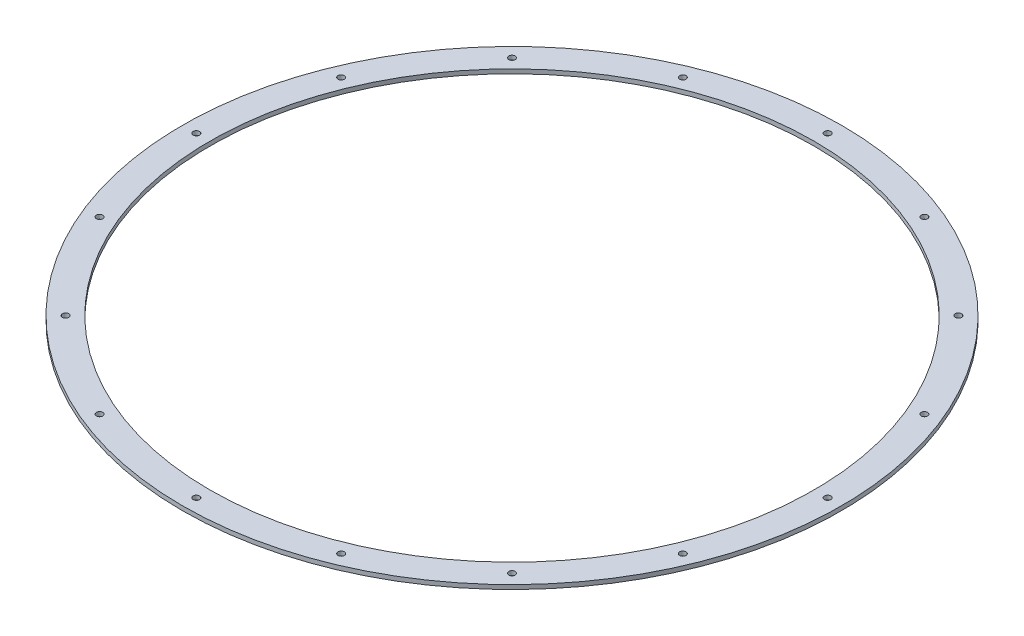
from build123d import *

# Parameters (mm, degrees)
SKETCH2_R           = 462
SKETCH2_R_2         = 423.5
BOSS_EXTRUDE1_DEPTH = 6
SKETCH3_R           = 4.5
CUT_EXTRUDE1_DEPTH  = 46
CIRPATTERN1_COUNT   = 16


with BuildPart() as part:
    # Sketch2 → Boss-Extrude1 (new body)
    with BuildSketch(Plane(origin=(0, 0, 0), x_dir=(1, 0, 0), z_dir=(0, 1, 0))):
        with Locations(Location((0, 0, 0), (0, 0, 270))):
            Circle(SKETCH2_R)
        with Locations(Location((0, 0, 0), (0, 0, 270))):
            Circle(SKETCH2_R_2, mode=Mode.SUBTRACT)
    extrude(amount=BOSS_EXTRUDE1_DEPTH)

    # Sketch3 → Cut-Extrude1 (cut)
    with BuildSketch(Plane(origin=(0, 6, 0), x_dir=(1, 0, 0), z_dir=(0, 1, 0))):
        with Locations(Location((0, 442.5, 0), (0, 0, 270))):
            Circle(SKETCH3_R)
    cut_extrude1 = extrude(amount=-CUT_EXTRUDE1_DEPTH, mode=Mode.SUBTRACT)

    # CirPattern1: Cut-Extrude1 ×16 about axis
    cirpattern1_axis = Axis((0, 0, 0), (0, 1, 0))
    for i in range(1, CIRPATTERN1_COUNT):
        add(cut_extrude1.rotate(cirpattern1_axis, i * 360 / CIRPATTERN1_COUNT), mode=Mode.SUBTRACT)


solid = part.part
